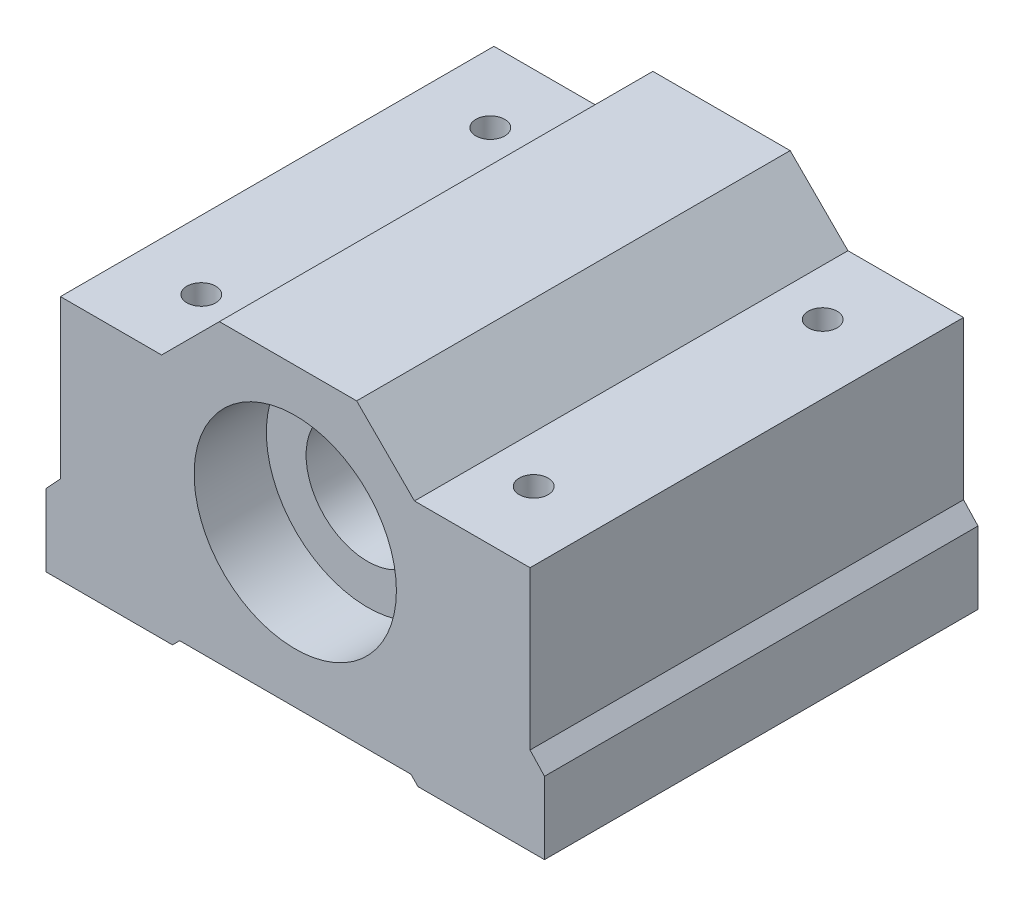
from build123d import *

# Parameters (mm, degrees)
SKETCH1_R             = 7
BOSS_EXTRUDE1_DEPTH   = 30
BOSS_EXTRUDE2_START   = -25
SKETCH3_R             = 7
SKETCH3_R_2           = 4.25
BOSS_EXTRUDE2_DEPTH   = 20
F_2_0MM_DOWEL_HOLE1_D = 2


with BuildPart() as part:
    # Sketch1 → Boss-Extrude1 (new body)
    # profile 1 of 2: a face of its own
    with BuildSketch(Plane.XY):
        Polygon((-16.25, 6.5), (16.25, 6.5), (16.25, -4.427166083), (17.25, -5.5), (17.25, -10.5), (8.5, -10.5), (8, -10), (-8, -10), (-8.5, -10.5), (-9, -10.5), (-17.25, -10.5), (-17.25, -5.5), (-16.25, -4.427166083), align=None)
        with Locations((0, 0.5)):
            Circle(SKETCH1_R, mode=Mode.SUBTRACT)
    # profile 2 of 2: a face of its own
    with BuildSketch(Plane.XY):
        with BuildLine():
            Line((3.605551275, 6.5), (8.25, 6.5))
            Line((8.25, 6.5), (4.25, 10.5))
            Line((4.25, 10.5), (-5.25, 10.5))
            Line((-5.25, 10.5), (-9.25, 6.5))
            Line((-9.25, 6.5), (-3.605551275, 6.5))
            ThreePointArc((-3.605551275, 6.5), (0, 7.5), (3.605551275, 6.5))
        make_face()
    extrude(amount=BOSS_EXTRUDE1_DEPTH)

    # Sketch3 → Boss-Extrude2 (add)
    with BuildSketch(Plane.XY.offset(30).offset(BOSS_EXTRUDE2_START)):
        with Locations((0, 0.5)):
            Circle(SKETCH3_R)
        with Locations((0, 0.5)):
            Circle(SKETCH3_R_2, mode=Mode.SUBTRACT)
    extrude(amount=BOSS_EXTRUDE2_DEPTH)

    # Ø2.0mm Dowel Hole1 (through all)
    with Locations(Plane(origin=(0, -10.5, 0), x_dir=(-1, 0, 0), z_dir=(0, -1, 0))):
        with Locations((11.5, -25), (11.5, -5), (-11.5, -5), (-11.5, -25)):
            Hole(F_2_0MM_DOWEL_HOLE1_D / 2)


solid = part.part
